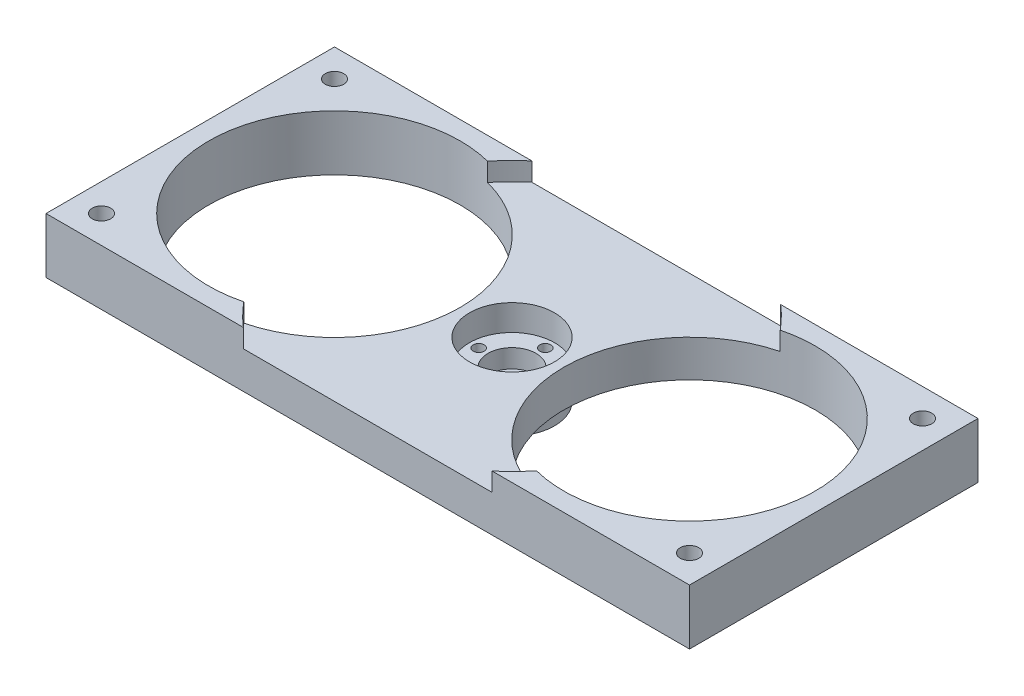
from build123d import *

# Parameters (mm, degrees)
SKETCH1_R           = 6.5
SKETCH1_R_2         = 2.5
BOSS_EXTRUDE1_DEPTH = 3
SKETCH1_3_R         = 11.5
SKETCH1_3_R_2       = 1.5
SKETCH1_3_R_3       = 6.5
BOSS_EXTRUDE2_DEPTH = 8
SKETCH1_4_R         = 11.5
BOSS_EXTRUDE3_DEPTH = 15
SKETCH1_5_R         = 2.5
BOSS_EXTRUDE4_DEPTH = 20
SKETCH3_W           = 174
SKETCH3_H           = 78
SKETCH3_R           = 11.5
CUT_EXTRUDE1_DEPTH  = 5


with BuildPart() as part:
    # Sketch1 → Boss-Extrude1 (new body)
    with BuildSketch(Plane(origin=(0, 0, 0), x_dir=(1, 0, 0), z_dir=(0, 1, 0))):
        Circle(SKETCH1_R)
        Circle(SKETCH1_R_2, mode=Mode.SUBTRACT)
    extrude(amount=BOSS_EXTRUDE1_DEPTH)



with BuildPart() as body_2:
    # Sketch1<3> → Boss-Extrude2 (new body)
    with BuildSketch(Plane(origin=(0, 0, 0), x_dir=(1, 0, 0), z_dir=(0, 1, 0))):
        Circle(SKETCH1_3_R)
        with Locations((-9, 0)):
            Circle(SKETCH1_3_R_2, mode=Mode.SUBTRACT)
        with Locations((0, -9)):
            Circle(SKETCH1_3_R_2, mode=Mode.SUBTRACT)
        Circle(SKETCH1_3_R_3, mode=Mode.SUBTRACT)
        with Locations((9, 0)):
            Circle(SKETCH1_3_R_2, mode=Mode.SUBTRACT)
        with Locations((0, 9)):
            Circle(SKETCH1_3_R_2, mode=Mode.SUBTRACT)
    extrude(amount=BOSS_EXTRUDE2_DEPTH)


with BuildPart() as part_1:
    add(part.part)

    add(body_2.part)  # Boss-Extrude3 merges body 2
    # Sketch1<4> → Boss-Extrude3 (add)
    with BuildSketch(Plane(origin=(0, 0, 0), x_dir=(1, 0, 0), z_dir=(0, 1, 0))):
        with BuildLine():
            ThreePointArc((39.5859375, 32.942427844), (36.735072586, 36.094105365), (33.634060118, 39))
            Line((33.634060118, 39), (-33.634060118, 39))
            ThreePointArc((-33.634060118, 39), (-36.735072586, 36.094105365), (-39.5859375, 32.942427844))
            ThreePointArc((-39.5859375, 32.942427844), (-21.147829464, 20.855717142), (-14, 0))
            ThreePointArc((-14, 0), (-21.147829464, -20.855717142), (-39.5859375, -32.942427844))
            ThreePointArc((-39.5859375, -32.942427844), (-36.735072586, -36.094105365), (-33.634060118, -39))
            Line((-33.634060118, -39), (33.634060118, -39))
            ThreePointArc((33.634060118, -39), (36.735072586, -36.094105365), (39.5859375, -32.942427844))
            ThreePointArc((39.5859375, -32.942427844), (14, 0), (39.5859375, 32.942427844))
        make_face()
        Circle(SKETCH1_4_R, mode=Mode.SUBTRACT)
    extrude(amount=BOSS_EXTRUDE3_DEPTH)

    # Sketch1<5> → Boss-Extrude4 (add)
    # profile 1 of 2: a face of its own
    with BuildSketch(Plane(origin=(0, 0, 0), x_dir=(1, 0, 0), z_dir=(0, 1, 0))):
        with BuildLine():
            Line((87, -39), (87, 39))
            Line((87, 39), (33.634060118, 39))
            ThreePointArc((33.634060118, 39), (36.735072586, 36.094105365), (39.5859375, 32.942427844))
            ThreePointArc((39.5859375, 32.942427844), (82, 0), (39.5859375, -32.942427844))
            ThreePointArc((39.5859375, -32.942427844), (36.735072586, -36.094105365), (33.634060118, -39))
            Line((33.634060118, -39), (87, -39))
        make_face()
        with Locations((79.5, -31.5)):
            Circle(SKETCH1_5_R, mode=Mode.SUBTRACT)
        with Locations((79.5, 31.5)):
            Circle(SKETCH1_5_R, mode=Mode.SUBTRACT)
    # profile 2 of 2: a face of its own
    with BuildSketch(Plane(origin=(0, 0, 0), x_dir=(1, 0, 0), z_dir=(0, 1, 0))):
        with BuildLine():
            ThreePointArc((-39.5859375, 32.942427844), (-36.735072586, 36.094105365), (-33.634060118, 39))
            Line((-33.634060118, 39), (-87, 39))
            Line((-87, 39), (-87, -39))
            Line((-87, -39), (-33.634060118, -39))
            ThreePointArc((-33.634060118, -39), (-36.735072586, -36.094105365), (-39.5859375, -32.942427844))
            ThreePointArc((-39.5859375, -32.942427844), (-82, 0), (-39.5859375, 32.942427844))
        make_face()
        with Locations((-79.5, -31.5)):
            Circle(SKETCH1_5_R, mode=Mode.SUBTRACT)
        with Locations((-79.5, 31.5)):
            Circle(SKETCH1_5_R, mode=Mode.SUBTRACT)
    extrude(amount=BOSS_EXTRUDE4_DEPTH)

    # Sketch3 → Cut-Extrude1 (cut)
    with BuildSketch(Plane.XZ):
        Rectangle(SKETCH3_W, SKETCH3_H)
        Circle(SKETCH3_R, mode=Mode.SUBTRACT)
    extrude(amount=-CUT_EXTRUDE1_DEPTH, mode=Mode.SUBTRACT)


solid = part_1.part
